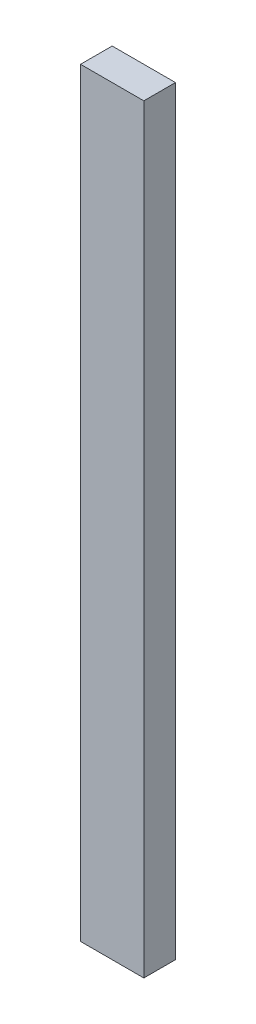
from build123d import *

# Parameters (mm, degrees)
SKETCH1_W           = 12.7
SKETCH1_H           = 152.4
BOSS_EXTRUDE1_DEPTH = 6.35


with BuildPart() as part:
    # Sketch1 → Boss-Extrude1 (new body)
    with BuildSketch(Plane.XY):
        Rectangle(SKETCH1_W, SKETCH1_H)
    extrude(amount=BOSS_EXTRUDE1_DEPTH)


solid = part.part
